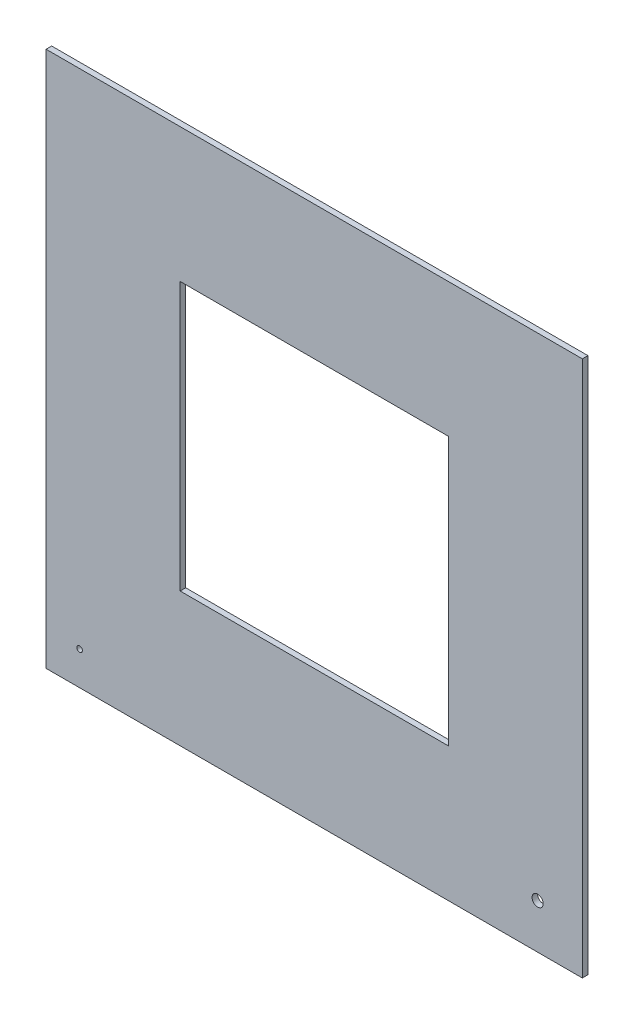
from build123d import *

# Parameters (mm, degrees)
SKETCH1_W           = 609.6
SKETCH1_H           = 609.6
BOSS_EXTRUDE1_DEPTH = 6.35
SKETCH2_R           = 6.35
CUT_EXTRUDE1_DEPTH  = 6.35
SKETCH3_W           = 304.8
SKETCH3_H           = 304.8
CUT_EXTRUDE2_DEPTH  = 432.099063441
SKETCH4_R           = 3.175
CUT_EXTRUDE3_DEPTH  = 432.099063441


with BuildPart() as part:
    # Sketch1 → Boss-Extrude1 (new body)
    with BuildSketch(Plane.XY):
        Rectangle(SKETCH1_W, SKETCH1_H)
    extrude(amount=BOSS_EXTRUDE1_DEPTH)

    # Sketch2 → Cut-Extrude1 (cut)
    with BuildSketch(Plane.XY.offset(6.35)):
        with Locations((254, -254)):
            Circle(SKETCH2_R)
    extrude(amount=-CUT_EXTRUDE1_DEPTH, mode=Mode.SUBTRACT)

    # Sketch3 → Cut-Extrude2 (cut, through all)
    with BuildSketch(Plane.XY.offset(6.35)):
        Rectangle(SKETCH3_W, SKETCH3_H)
    extrude(amount=-CUT_EXTRUDE2_DEPTH, mode=Mode.SUBTRACT)

    # Sketch4 → Cut-Extrude3 (cut, through all)
    with BuildSketch(Plane.XY.offset(6.35)):
        with Locations((-266.7, -266.7)):
            Circle(SKETCH4_R)
    extrude(amount=-CUT_EXTRUDE3_DEPTH, mode=Mode.SUBTRACT)


solid = part.part
